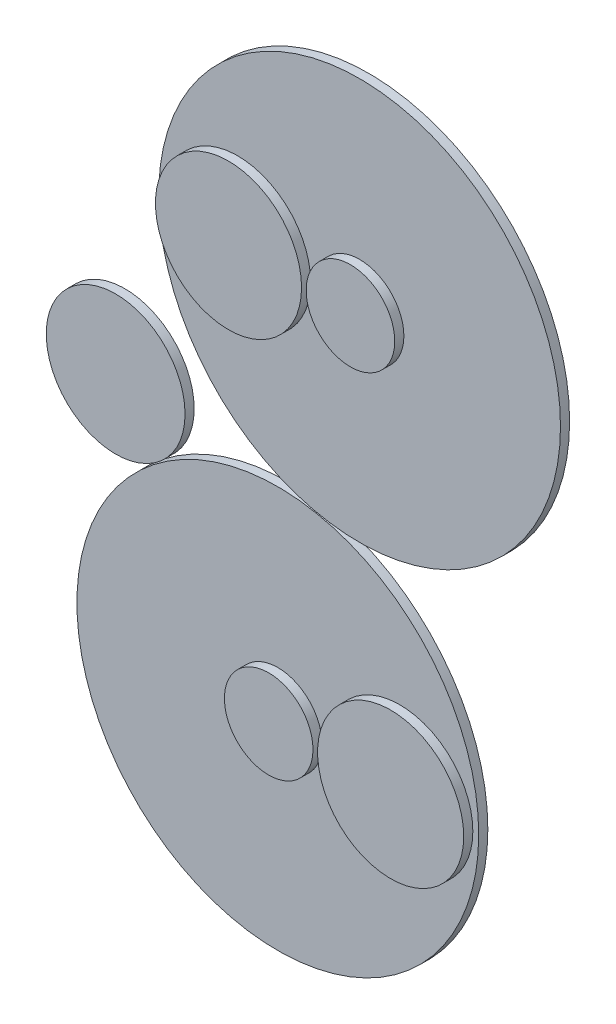
from build123d import *

# Parameters (mm, degrees)
ESBO_O2_R                  = 22
RESSALTO_EXTRUS_O1_DEPTH   = 1
RESSALTO_EXTRUS_O1_2_DEPTH = 1
ESBO_O2_R_2                = 7.6
RESSALTO_EXTRUS_O1_3_DEPTH = 1
ESBO_O3_R                  = 4.85
ESBO_O3_R_2                = 8
RESSALTO_EXTRUS_O2_DEPTH   = 1


with BuildPart() as part:
    # Esboço2 → Ressalto-extrusão1 (new body)
    with BuildSketch(Plane.XY):
        Circle(ESBO_O2_R)
    extrude(amount=RESSALTO_EXTRUS_O1_DEPTH)



with BuildPart() as body_2:
    # Esboço2 → Ressalto-extrus_o1 2 (new body)
    with BuildSketch(Plane.XY):
        with Locations((8.954, 43.181429851)):
            Circle(ESBO_O2_R)
    extrude(amount=RESSALTO_EXTRUS_O1_2_DEPTH)


with BuildPart() as body_3:
    # Esboço2 → Ressalto-extrus_o1 3 (new body)
    with BuildSketch(Plane.XY):
        with Locations((-17.758926266, 23.80568289)):
            Circle(ESBO_O2_R_2)
    extrude(amount=RESSALTO_EXTRUS_O1_3_DEPTH)


with BuildPart() as part_1:
    add(part.part)

    add(body_2.part)  # Ressalto-extrusão2 merges body 2
    # Esboço3 → Ressalto-extrusão2 (add)
    with BuildSketch(Plane.XY.offset(1)):
        with Locations((8.954, 43.181429851)):
            Circle(ESBO_O3_R)
        Circle(ESBO_O3_R)
        with Locations((-4.401, 43.181429851)):
            Circle(ESBO_O3_R_2)
        with Locations((13.355, 0)):
            Circle(ESBO_O3_R_2)
    extrude(amount=RESSALTO_EXTRUS_O2_DEPTH)


solid = Compound([body_3.part, part_1.part])
